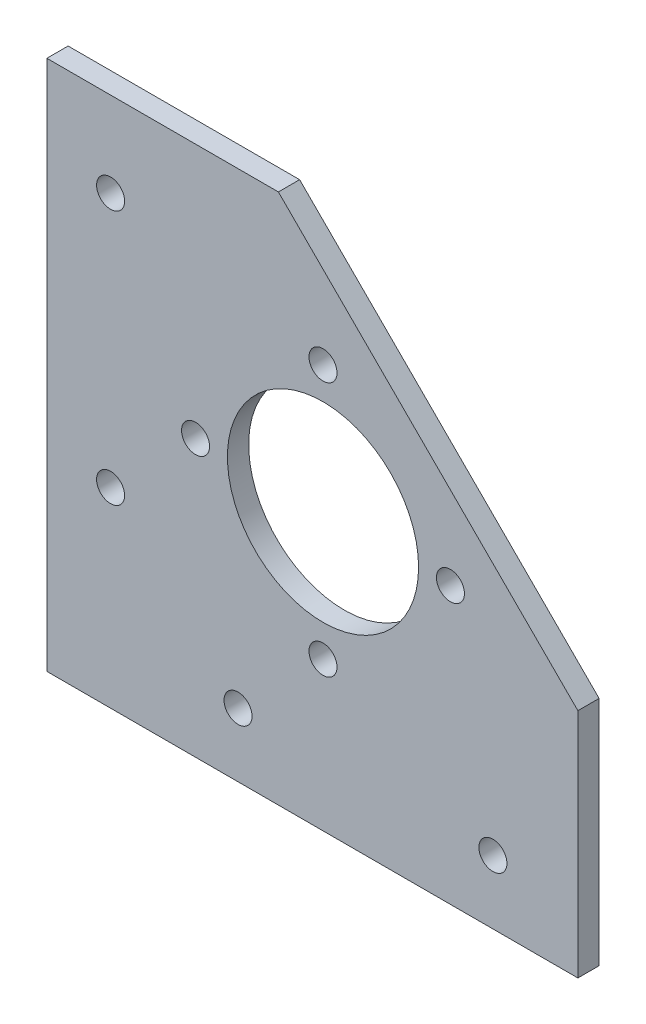
from build123d import *

# Parameters (mm, degrees)
SKETCH_1_R            = 22.5
EXTRUDE_1_DEPTH       = 5
HOLE_WIZARD_M61_D     = 6.6
HOLE_WIZARD_M61_DEPTH = 10
HOLE_WIZARD_M61_TIP   = 1.982840043


with BuildPart() as part:
    # Эскиз1 → Бобышка-Вытянуть1 (new body)
    with BuildSketch(Plane.XY):
        Polygon((0, 0), (0, 125), (54.497474683, 125), (125, 54.497474683), (125, 0), align=None)
        with Locations((65, 65)):
            Circle(SKETCH_1_R, mode=Mode.SUBTRACT)
    extrude(amount=EXTRUDE_1_DEPTH)

    # Отверстие с зазором M61
    with Locations(Plane(origin=(0, 0, 0), x_dir=(-1, 0, 0), z_dir=(0, 0, -1))):
        with Locations((-95, 65), (-65, 95), (-35, 65), (-65, 35), (-105, 15), (-45, 15), (-15, 45), (-15, 105)):
            Hole(HOLE_WIZARD_M61_D / 2, depth=HOLE_WIZARD_M61_DEPTH)
            with Locations((0, 0, -(HOLE_WIZARD_M61_DEPTH + HOLE_WIZARD_M61_TIP / 2))):  # 118° drill point
                Cone(0, HOLE_WIZARD_M61_D / 2, HOLE_WIZARD_M61_TIP, mode=Mode.SUBTRACT)


solid = part.part
